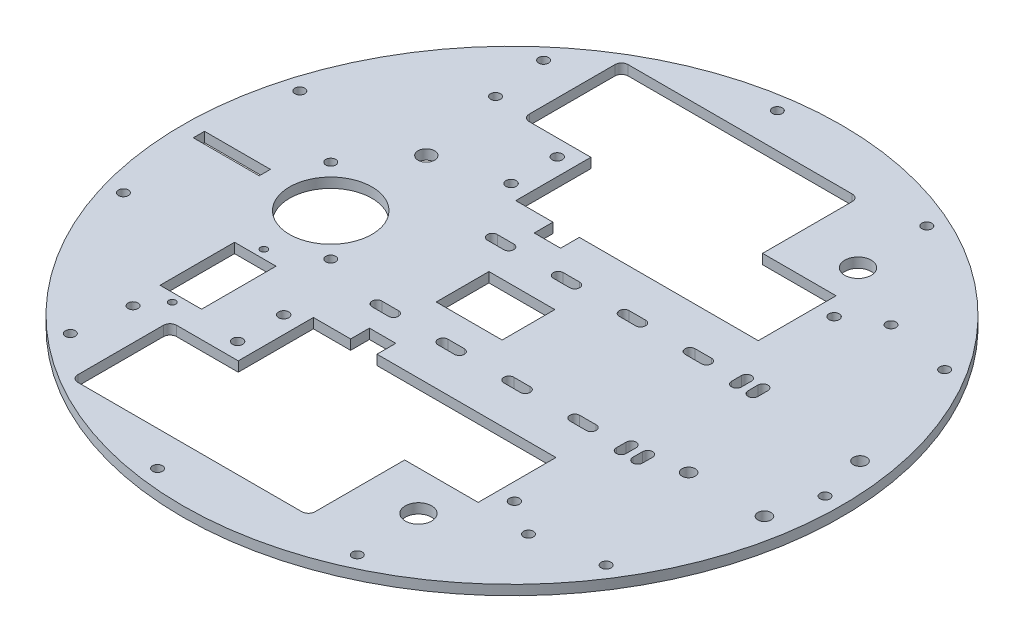
from build123d import *

# Parameters (mm, degrees)
SKETCH_2_R           = 100
EXTRUDE_1_DEPTH      = 3
SKETCH_4_R           = 12.5
CUT_EXTRUDE_2_DEPTH  = 3
SKETCH_5_R           = 1.5
CUT_EXTRUDE_3_DEPTH  = 3
SKETCH_6_R           = 4
CUT_EXTRUDE_4_DEPTH  = 10
EXTRUDE_2_DEPTH      = 3
SKETCH_9_W           = 20
SKETCH_9_H           = 3.4
CUT_EXTRUDE_6_DEPTH  = 3
SKETCH_11_R          = 2.5
CUT_EXTRUDE_9_DEPTH  = 10
CUT_EXTRUDE_START    = -10
SKETCH_12_R          = 174.046690734
SKETCH_12_R_2        = 100
CUT_EXTRUDE_10_DEPTH = 10
SKETCH_13_R          = 1.55
CUT_EXTRUDE_12_DEPTH = 3
SKETCH_16_W          = 12.589556248
SKETCH_16_H          = 22.605819461
SKETCH_16_R          = 2.5
CUT_EXTRUDE_14_DEPTH = 3
CUT_EXTRUDE_15_DEPTH = 3
SKETCH_18_W          = 20
SKETCH_18_H          = 16
CUT_EXTRUDE_16_DEPTH = 3
SKETCH_19_R          = 1.5
CUT_EXTRUDE_17_DEPTH = 3
SKETCH_20_R          = 1.5
CUT_EXTRUDE_18_DEPTH = 3
CUT_EXTRUDE_19_DEPTH = 3
FILLET_1_R           = 2
SKETCH_14_R          = 2
CUT_EXTRUDE_21_DEPTH = 10


with BuildPart() as part:
    # 草圖2 → 填料-伸長1 (new body)
    with BuildSketch(Plane(origin=(0, 0, 0), x_dir=(1, 0, 0), z_dir=(0, 1, 0))):
        with Locations(Location((0, 0, 0), (0, 0, 270))):
            Circle(SKETCH_2_R)
    extrude(amount=EXTRUDE_1_DEPTH)

    # 草圖4 → 除料-伸長2 (cut)
    with BuildSketch(Plane(origin=(0, 3, 0), x_dir=(1, 0, 0), z_dir=(0, 1, 0))):
        with Locations(Location((-55, 0, 0), (0, 0, 270))):
            Circle(SKETCH_4_R)
    extrude(amount=-CUT_EXTRUDE_2_DEPTH, mode=Mode.SUBTRACT)

    # 草圖5 → 除料-伸長3 (cut)
    with BuildSketch(Plane(origin=(0, 3, 0), x_dir=(1, 0, 0), z_dir=(0, 1, 0))):
        with Locations(Location((-60, 55, 0), (0, 0, 270))):
            Circle(SKETCH_5_R)
        with Locations(Location((-60, -55, 0), (0, 0, 270))):
            Circle(SKETCH_5_R)
        with Locations(Location((60, -55, 0), (0, 0, 270))):
            Circle(SKETCH_5_R)
        with Locations(Location((60, 55, 0), (0, 0, 270))):
            Circle(SKETCH_5_R)
    extrude(amount=-CUT_EXTRUDE_3_DEPTH, mode=Mode.SUBTRACT)

    # 草圖6 → 除料-伸長4 (cut)
    with BuildSketch(Plane(origin=(0, 3, 0), x_dir=(1, 0, 0), z_dir=(0, 1, 0))):
        with Locations(Location((40, 65, 0), (0, 0, 270))):
            Circle(SKETCH_6_R)
        with Locations(Location((37.878902577, -66.258499376, 0), (0, 0, 270))):
            Circle(SKETCH_6_R)
    extrude(amount=-CUT_EXTRUDE_4_DEPTH, mode=Mode.SUBTRACT)

    # 草圖8 → 填料-伸長2 (add)
    with BuildSketch(Plane(origin=(0, 3, 0), x_dir=(1, 0, 0), z_dir=(0, 1, 0))):
        with BuildLine():
            Line((-99.215674165, 12.5), (-111.215674165, 12.5))
            ThreePointArc((-111.215674165, 12.5), (-113.336994508, 11.621320344), (-114.215674165, 9.5))
            Line((-114.215674165, 9.5), (-114.215674165, -9.5))
            ThreePointArc((-114.215674165, -9.5), (-113.336994508, -11.621320344), (-111.215674165, -12.5))
            Line((-111.215674165, -12.5), (-99.215674165, -12.5))
            Line((-99.215674165, -12.5), (-99.215674165, 12.5))
        make_face()
    extrude(amount=-EXTRUDE_2_DEPTH)

    # 草圖9 → 除料-伸長6 (cut)
    with BuildSketch(Plane(origin=(0, 3, 0), x_dir=(1, 0, 0), z_dir=(0, 1, 0))):
        with Locations((-85, 0)):
            Rectangle(SKETCH_9_W, SKETCH_9_H)
    extrude(amount=-CUT_EXTRUDE_6_DEPTH, mode=Mode.SUBTRACT)

    # 草圖11 → 除料-伸長9 (cut)
    with BuildSketch(Plane(origin=(0, 3, 0), x_dir=(1, 0, 0), z_dir=(0, 1, 0))):
        with Locations(Location((-55, -29, 0), (0, 0, 270))):
            Circle(SKETCH_11_R)
        with Locations(Location((-55, 29, 0), (0, 0, 270))):
            Circle(SKETCH_11_R)
    extrude(amount=-CUT_EXTRUDE_9_DEPTH, mode=Mode.SUBTRACT)

    # 草圖12 → 除料-伸長10 (cut)
    with BuildSketch(Plane(origin=(0, 3, 0), x_dir=(1, 0, 0), z_dir=(0, 1, 0)).offset(CUT_EXTRUDE_START)):
        Circle(SKETCH_12_R)
        with Locations(Location((0, 0, 0), (0, 0, 270))):
            Circle(SKETCH_12_R_2, mode=Mode.SUBTRACT)
    extrude(amount=CUT_EXTRUDE_10_DEPTH, mode=Mode.SUBTRACT)

    # 草圖13 → 除料-伸長12 (cut)
    with BuildSketch(Plane(origin=(0, 3, 0), x_dir=(1, 0, 0), z_dir=(0, 1, 0))):
        Polygon((-29.565632174, 30.7), (-18.265632174, 30.7), (-18.265632174, 25), (-10.265632174, 25), (-10.265632174, 30.7), (44.034367826, 30.7), (44.034367826, 54.3), (21.734367826, 54.3), (21.734367826, 83.5), (-50.265632174, 83.5), (-50.265632174, 53.5), (-29.565632174, 53.5), align=None)
        Polygon((-50.265632174, -53.5), (-50.265632174, -83.5), (21.734367826, -83.5), (21.734367826, -54.3), (44.034367826, -54.3), (44.034367826, -30.7), (-10.265632174, -30.7), (-10.265632174, -25), (-18.265632174, -25), (-18.265632174, -30.7), (-29.565632174, -30.7), (-29.565632174, -53.5), align=None)
        with Locations(Location((-34.765632174, 34.5, 0), (0, 0, 270))):
            Circle(SKETCH_13_R)
        with Locations(Location((49.234367826, 48.5, 0), (0, 0, 270))):
            Circle(SKETCH_13_R)
        with Locations(Location((-34.765632174, 48.5, 0), (0, 0, 270))):
            Circle(SKETCH_13_R)
        with Locations(Location((-34.765632174, -34.5, 0), (0, 0, 90))):
            Circle(SKETCH_13_R)
        with Locations(Location((49.234367826, -48.5, 0), (0, 0, 90))):
            Circle(SKETCH_13_R)
        with Locations(Location((-34.765632174, -48.5, 0), (0, 0, 90))):
            Circle(SKETCH_13_R)
    extrude(amount=-CUT_EXTRUDE_12_DEPTH, mode=Mode.SUBTRACT)

    # 草圖16 → 除料-伸長14 (cut)
    # profile 1 of 3: a face of its own
    with BuildSketch(Plane(origin=(0, 3, 0), x_dir=(1, 0, 0), z_dir=(0, 1, 0))):
        with Locations((-54.997597322, -34.199999445)):
            Rectangle(SKETCH_16_W, SKETCH_16_H)
        with Locations((-55, -29)):
            Circle(SKETCH_16_R, mode=Mode.SUBTRACT)
    # profile 2 of 3: a face of its own
    with BuildSketch(Plane(origin=(0, 3, 0), x_dir=(1, 0, 0), z_dir=(0, 1, 0))):
        with BuildLine():
            ThreePointArc((-55.590776571, -48.961959498), (-54.990689623, -49.149997849), (-54.390776699, -48.961405034))
            ThreePointArc((-54.390776699, -48.961405034), (-54.060336989, -48.585838478), (-53.941174779, -48.099997961))
            ThreePointArc((-53.941174779, -48.099997961), (-55.477445341, -47.169384754), (-55.590776571, -48.961959498))
        make_face()
    # profile 3 of 3: a face of its own
    with BuildSketch(Plane(origin=(0, 3, 0), x_dir=(1, 0, 0), z_dir=(0, 1, 0))):
        with BuildLine():
            ThreePointArc((-54.404418073, -19.438039392), (-55.004505021, -19.250001041), (-55.604417945, -19.438593856))
            ThreePointArc((-55.604417945, -19.438593856), (-55.489860382, -21.230838719), (-53.954019865, -20.300000929))
            ThreePointArc((-53.954019865, -20.300000929), (-54.073406658, -19.813730367), (-54.404418073, -19.438039392))
        make_face()
    extrude(amount=-CUT_EXTRUDE_14_DEPTH, mode=Mode.SUBTRACT)

    # 草圖17 → 除料-伸長15 (cut)
    with BuildSketch(Plane.XZ):
        with BuildLine():
            Line((36.534367826, 19.000000035), (41.534367826, 19.000000035))
            ThreePointArc((41.534367826, 19.000000035), (43.034367826, 17.500000035), (41.534367826, 16.000000035))
            Line((41.534367826, 16.000000035), (36.534367826, 16.000000035))
            ThreePointArc((36.534367826, 16.000000035), (35.034367826, 17.500000035), (36.534367826, 19.000000035))
        make_face()
        with BuildLine():
            Line((16.534367826, 16.000000035), (21.534367826, 16.000000035))
            ThreePointArc((21.534367826, 16.000000035), (23.034367826, 17.500000035), (21.534367826, 19.000000035))
            Line((21.534367826, 19.000000035), (16.534367826, 19.000000035))
            ThreePointArc((16.534367826, 19.000000035), (15.034367826, 17.500000035), (16.534367826, 16.000000035))
        make_face()
        with BuildLine():
            Line((-3.465632174, 16.000000035), (1.534367826, 16.000000035))
            ThreePointArc((1.534367826, 16.000000035), (3.034367826, 17.500000035), (1.534367826, 19.000000035))
            Line((1.534367826, 19.000000035), (-3.465632174, 19.000000035))
            ThreePointArc((-3.465632174, 19.000000035), (-4.965632174, 17.500000035), (-3.465632174, 16.000000035))
        make_face()
        with BuildLine():
            Line((-23.465632174, 16.000000035), (-18.465632174, 16.000000035))
            ThreePointArc((-18.465632174, 16.000000035), (-16.965632174, 17.500000035), (-18.465632174, 19.000000035))
            Line((-18.465632174, 19.000000035), (-23.465632174, 19.000000035))
            ThreePointArc((-23.465632174, 19.000000035), (-24.965632174, 17.500000035), (-23.465632174, 16.000000035))
        make_face()
        with BuildLine():
            Line((36.534367826, -19.000000035), (41.534367826, -19.000000035))
            ThreePointArc((41.534367826, -19.000000035), (43.034367826, -17.500000035), (41.534367826, -16.000000035))
            Line((41.534367826, -16.000000035), (36.534367826, -16.000000035))
            ThreePointArc((36.534367826, -16.000000035), (35.034367826, -17.500000035), (36.534367826, -19.000000035))
        make_face()
        with BuildLine():
            Line((16.534367826, -19.000000035), (21.534367826, -19.000000035))
            ThreePointArc((21.534367826, -19.000000035), (23.034367826, -17.500000035), (21.534367826, -16.000000035))
            Line((21.534367826, -16.000000035), (16.534367826, -16.000000035))
            ThreePointArc((16.534367826, -16.000000035), (15.034367826, -17.500000035), (16.534367826, -19.000000035))
        make_face()
        with BuildLine():
            Line((-3.465632174, -19.000000035), (1.534367826, -19.000000035))
            ThreePointArc((1.534367826, -19.000000035), (3.034367826, -17.500000035), (1.534367826, -16.000000035))
            Line((1.534367826, -16.000000035), (-3.465632174, -16.000000035))
            ThreePointArc((-3.465632174, -16.000000035), (-4.965632174, -17.500000035), (-3.465632174, -19.000000035))
        make_face()
        with BuildLine():
            Line((-23.465632174, -19.000000035), (-18.465632174, -19.000000035))
            ThreePointArc((-18.465632174, -19.000000035), (-16.965632174, -17.500000035), (-18.465632174, -16.000000035))
            Line((-18.465632174, -16.000000035), (-23.465632174, -16.000000035))
            ThreePointArc((-23.465632174, -16.000000035), (-24.965632174, -17.500000035), (-23.465632174, -19.000000035))
        make_face()
    extrude(amount=-CUT_EXTRUDE_15_DEPTH, mode=Mode.SUBTRACT)

    # 草圖18 → 除料-伸長16 (cut)
    with BuildSketch(Plane.XZ):
        with Locations((-5, 0)):
            Rectangle(SKETCH_18_W, SKETCH_18_H)
    extrude(amount=-CUT_EXTRUDE_16_DEPTH, mode=Mode.SUBTRACT)

    # 草圖19 → 除料-伸長17 (cut)
    with BuildSketch(Plane(origin=(0, 3, 0), x_dir=(1, 0, 0), z_dir=(0, 1, 0))):
        with Locations(Location((-67.727922061, 12.727922061, 0), (0, 0, 270))):
            Circle(SKETCH_19_R)
        with Locations(Location((-42.272077939, -12.727922061, 0), (0, 0, 270))):
            Circle(SKETCH_19_R)
    extrude(amount=-CUT_EXTRUDE_17_DEPTH, mode=Mode.SUBTRACT)

    # 草圖20 → 除料-伸長18 (cut)
    with BuildSketch(Plane.XZ):
        with Locations(Location((95, 0, 0), (0, 0, 270))):
            Circle(SKETCH_20_R)
        with Locations(Location((79.919085619, -51.360877658, 0), (0, 0, 270))):
            Circle(SKETCH_20_R)
        with Locations(Location((39.464426235, -86.415039559, 0), (0, 0, 270))):
            Circle(SKETCH_20_R)
        with Locations(Location((-13.519909636, -94.033036979, 0), (0, 0, 270))):
            Circle(SKETCH_20_R)
        with Locations(Location((-62.211769725, -71.796209564, 0), (0, 0, 270))):
            Circle(SKETCH_20_R)
        with Locations(Location((-91.151832493, -26.7645929, 0), (0, 0, 270))):
            Circle(SKETCH_20_R)
        with Locations(Location((-91.151832493, 26.7645929, 0), (0, 0, 270))):
            Circle(SKETCH_20_R)
        with Locations(Location((-62.211769725, 71.796209564, 0), (0, 0, 270))):
            Circle(SKETCH_20_R)
        with Locations(Location((-13.519909636, 94.033036979, 0), (0, 0, 270))):
            Circle(SKETCH_20_R)
        with Locations(Location((39.464426235, 86.415039559, 0), (0, 0, 270))):
            Circle(SKETCH_20_R)
        with Locations(Location((79.919085619, 51.360877658, 0), (0, 0, 270))):
            Circle(SKETCH_20_R)
    extrude(amount=-CUT_EXTRUDE_18_DEPTH, mode=Mode.SUBTRACT)

    # 草圖21 → 除料-伸長19 (cut)
    with BuildSketch(Plane.XZ):
        with BuildLine():
            Line((50.642037027, -19.000000035), (50.642037027, -16.000000035))
            ThreePointArc((50.642037027, -16.000000035), (52.142037027, -14.500000035), (53.642037027, -16.000000035))
            Line((53.642037027, -16.000000035), (53.642037027, -19.000000035))
            ThreePointArc((53.642037027, -19.000000035), (52.142037027, -20.500000035), (50.642037027, -19.000000035))
        make_face()
        with BuildLine():
            Line((55.642037027, -19.000000035), (55.642037027, -16.000000035))
            ThreePointArc((55.642037027, -16.000000035), (57.142037027, -14.500000035), (58.642037027, -16.000000035))
            Line((58.642037027, -16.000000035), (58.642037027, -19.000000035))
            ThreePointArc((58.642037027, -19.000000035), (57.142037027, -20.500000035), (55.642037027, -19.000000035))
        make_face()
        with BuildLine():
            Line((55.642037027, 19.000000035), (55.642037027, 16.000000035))
            ThreePointArc((55.642037027, 16.000000035), (57.142037027, 14.500000035), (58.642037027, 16.000000035))
            Line((58.642037027, 16.000000035), (58.642037027, 19.000000035))
            ThreePointArc((58.642037027, 19.000000035), (57.142037027, 20.500000035), (55.642037027, 19.000000035))
        make_face()
        with BuildLine():
            Line((50.642037027, 19.000000035), (50.642037027, 16.000000035))
            ThreePointArc((50.642037027, 16.000000035), (52.142037027, 14.500000035), (53.642037027, 16.000000035))
            Line((53.642037027, 16.000000035), (53.642037027, 19.000000035))
            ThreePointArc((53.642037027, 19.000000035), (52.142037027, 20.500000035), (50.642037027, 19.000000035))
        make_face()
    extrude(amount=-CUT_EXTRUDE_19_DEPTH, mode=Mode.SUBTRACT)

    # 圓角1
    fillet_1_edges = [part.edges().sort_by_distance(p)[0] for p in [
        (21.734367826, 1.5, 83.5),
        (-50.265632174, 1.5, 83.5),
        (-50.265632174, 1.5, 53.5),
        (-50.265632174, 1.5, -53.5),
        (-50.265632174, 1.5, -83.5),
        (21.734367826, 1.5, -83.5),
    ]]
    fillet(fillet_1_edges, radius=FILLET_1_R)

    # 草圖14 → 除料-伸長21 (cut)
    with BuildSketch(Plane(origin=(0, 3, 0), x_dir=(1, 0, 0), z_dir=(0, 1, 0))):
        with Locations(Location((91.099215454, 14.5, 0), (0, 0, 270))):
            Circle(SKETCH_14_R)
        with Locations(Location((91.099215454, -14.5, 0), (0, 0, 270))):
            Circle(SKETCH_14_R)
        with Locations(Location((68.099215454, -14.5, 0), (0, 0, 270))):
            Circle(SKETCH_14_R)
    extrude(amount=-CUT_EXTRUDE_21_DEPTH, mode=Mode.SUBTRACT)


solid = part.part
